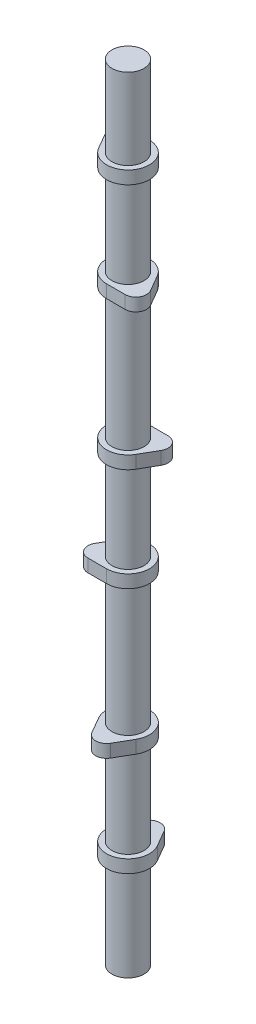
from build123d import *

# Parameters (mm, degrees)
BOSS_EXTRUDE1_DEPTH   = 3.81
LPATTERN1_COUNT       = 2
LPATTERN1_PITCH       = 60.96
BODY_MOVE_COPY1_ANGLE = 180
LPATTERN2_COUNT       = 3
LPATTERN2_PITCH       = 146.05
BODY_MOVE_COPY2_ANGLE = 120
BODY_MOVE_COPY3_ANGLE = 120
BOSS_EXTRUDE2_START   = -59.53
SKETCH5_R             = 9.5
BOSS_EXTRUDE2_DEPTH   = 464.25


with BuildPart() as part:
    # Sketch2 → Boss-Extrude1 (new, symmetric)
    with BuildSketch(Plane(origin=(0, 0, 0), x_dir=(1, 0, 0), z_dir=(0, 1, 0))):
        with BuildLine():
            Line((-5.499261314, 15.875), (-10.998522628, 6.35))
            ThreePointArc((-10.998522628, 6.35), (0, -12.7), (10.998522628, 6.35))
            Line((10.998522628, 6.35), (5.499261314, 15.875))
            ThreePointArc((5.499261314, 15.875), (0, 19.05), (-5.499261314, 15.875))
        make_face()
    extrude(amount=BOSS_EXTRUDE1_DEPTH, both=True)


with BuildPart() as lpattern1_1:
    # LPattern1: pattern copy
    add(part.part.moved(Location(Vector(0, 1, 0) * (1 * LPATTERN1_PITCH))))


with BuildPart() as lpattern1_1_1:
    # Body-Move/Copy1: moved
    add(lpattern1_1.part.rotate(Axis((0, 0, 0), (0, 1, 0)), BODY_MOVE_COPY1_ANGLE))


with BuildPart() as lpattern2_1:
    # LPattern2: pattern copy
    add(part.part.moved(Location(Vector(0, 1, 0) * (1 * LPATTERN2_PITCH))))


with BuildPart() as lpattern2_2:
    # LPattern2: pattern copy
    add(part.part.moved(Location(Vector(0, 1, 0) * (2 * LPATTERN2_PITCH))))


with BuildPart() as lpattern2_3:
    # LPattern2: pattern copy
    add(lpattern1_1_1.part.moved(Location(Vector(0, 1, 0) * (1 * LPATTERN2_PITCH))))


with BuildPart() as lpattern2_4:
    # LPattern2: pattern copy
    add(lpattern1_1_1.part.moved(Location(Vector(0, 1, 0) * (2 * LPATTERN2_PITCH))))


with BuildPart() as lpattern2_1_1:
    # Body-Move/Copy2: moved
    add(lpattern2_1.part.rotate(Axis((0, 0, 0), (0, 1, 0)), BODY_MOVE_COPY2_ANGLE))


with BuildPart() as lpattern2_3_1:
    # Body-Move/Copy2: moved
    add(lpattern2_3.part.rotate(Axis((0, 0, 0), (0, 1, 0)), BODY_MOVE_COPY2_ANGLE))


with BuildPart() as lpattern2_4_1:
    # Body-Move/Copy3: moved
    add(lpattern2_4.part.rotate(Axis((0, 0, 0), (0, -1, 0)), BODY_MOVE_COPY3_ANGLE))


with BuildPart() as lpattern2_2_1:
    # Body-Move/Copy3: moved
    add(lpattern2_2.part.rotate(Axis((0, 0, 0), (0, -1, 0)), BODY_MOVE_COPY3_ANGLE))


with BuildPart() as part_1:
    add(part.part)

    add(lpattern1_1_1.part)  # Boss-Extrude2 merges LPattern1_1

    add(lpattern2_1_1.part)  # Boss-Extrude2 merges LPattern2_1

    add(lpattern2_2_1.part)  # Boss-Extrude2 merges LPattern2_2

    add(lpattern2_3_1.part)  # Boss-Extrude2 merges LPattern2_3

    add(lpattern2_4_1.part)  # Boss-Extrude2 merges LPattern2_4
    # Sketch5 → Boss-Extrude2 (add)
    with BuildSketch(Plane(origin=(0, 0, 0), x_dir=(1, 0, 0), z_dir=(0, 1, 0)).offset(BOSS_EXTRUDE2_START)):
        Circle(SKETCH5_R)
    extrude(amount=BOSS_EXTRUDE2_DEPTH)


solid = part_1.part
